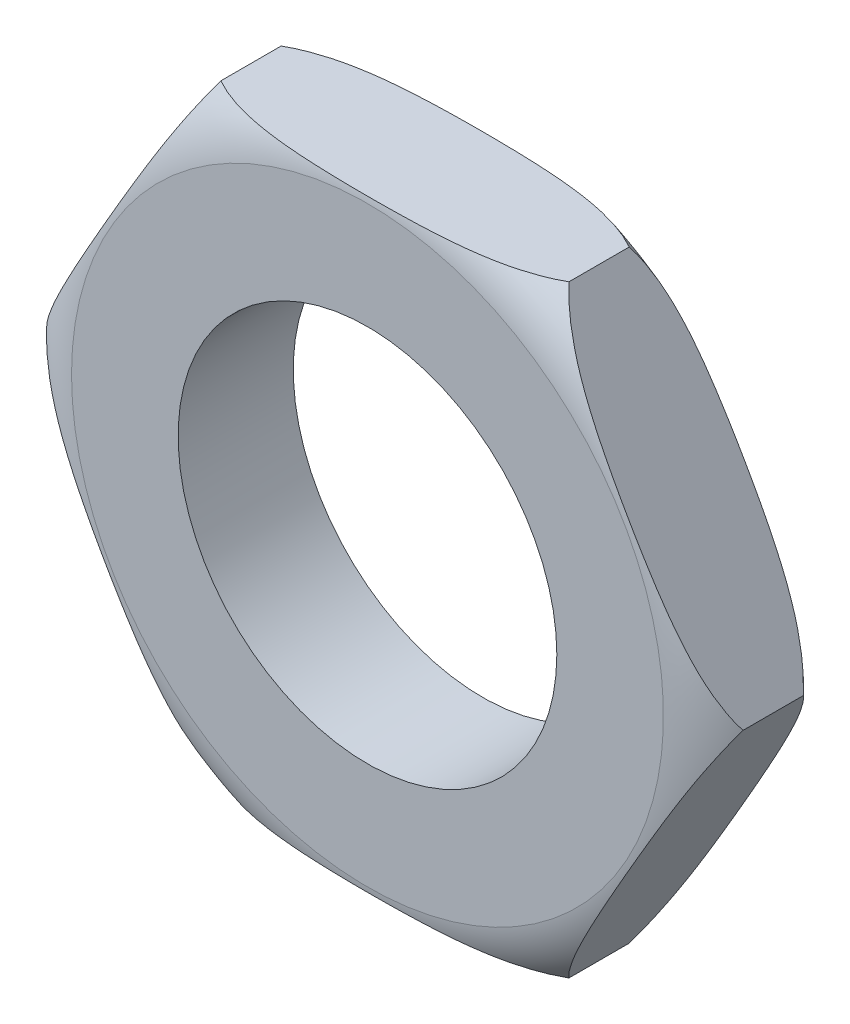
from build123d import *

# Parameters (mm, degrees)
BOSS_EXTRUDE1_DEPTH      = 1.05
F_5_16_24_TAPPED_HOLE1_D = 6.9088


with BuildPart() as part:
    # Sketch2 → Boss-Extrude1 (new, symmetric)
    with BuildSketch(Plane.XY):
        Polygon((-3.175426481, -5.5), (3.175426481, -5.5), (6.350852961, 0), (3.175426481, 5.5), (-3.175426481, 5.5), (-6.350852961, 0), align=None)
    extrude(amount=BOSS_EXTRUDE1_DEPTH, both=True)

    # 5/16-24 Tapped Hole1 (through all)
    with Locations(Plane.XY.offset(1.05)):
        with Locations((0, 0)):
            Hole(F_5_16_24_TAPPED_HOLE1_D / 2)

    # Sketch7 → Cut-Revolve2 (revolve, cut)
    with BuildSketch(Plane(origin=(0, 0, 0), x_dir=(1, 0, 0), z_dir=(0, 1, 0)), mode=Mode.PRIVATE) as cut_revolve2_sk:
        with BuildLine():
            Line((-6.350852961, -0.55), (-6.350852961, -1.05))
            Line((-6.350852961, -1.05), (-5.4, -1.05))
            ThreePointArc((-5.4, -1.05), (-5.921724154, -0.888044561), (-6.350852961, -0.55))
        make_face()
    cut_revolve2 = revolve(cut_revolve2_sk.sketch.rotate(Axis((0, 0, 0), (0, 0, 1)), 180), axis=Axis((0, 0, 0), (0, 0, 1)), mode=Mode.SUBTRACT)

    # Mirror1: Cut-Revolve2 across plane
    add(cut_revolve2.mirror(Plane.XY), mode=Mode.SUBTRACT)


solid = part.part
